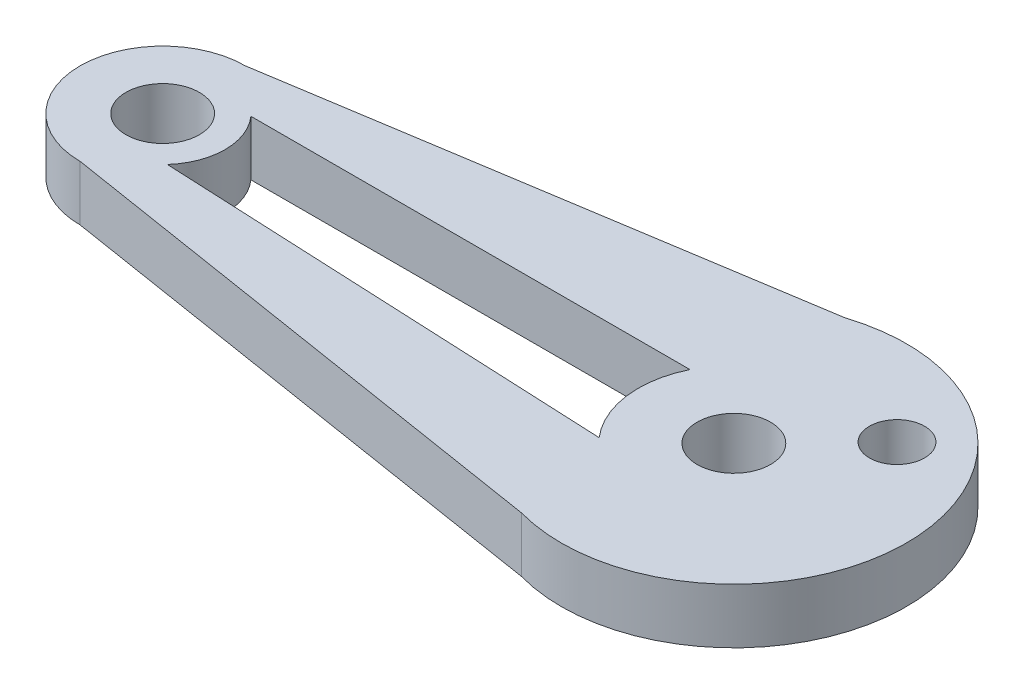
from build123d import *

# Parameters (mm, degrees)
SKETCH1_R           = 2
SKETCH1_R_2         = 1.5
BOSS_EXTRUDE1_DEPTH = 3


with BuildPart() as part:
    # Sketch1 → Boss-Extrude1 (new body)
    with BuildSketch(Plane(origin=(0, 0, 0), x_dir=(1, 0, 0), z_dir=(0, 1, 0))):
        with BuildLine():
            Line((-51.730151438, -5.002739553), (-23.52046035, -0.558125845))
            ThreePointArc((-23.52046035, -0.558125845), (-11.232359056, -9.299028138), (-23.130151438, -18.56419639))
            Line((-23.130151438, -18.56419639), (-51.730151438, -14.002739553))
            ThreePointArc((-51.730151438, -14.002739553), (-56.230151438, -9.502739553), (-51.730151438, -5.002739553))
        make_face()
        with Locations(Location((-20.630151438, -9.502739553, 0), (0, 0, 270))):
            Circle(SKETCH1_R, mode=Mode.SUBTRACT)
        with Locations(Location((-51.730151438, -9.502739553, 0), (0, 0, 270))):
            Circle(SKETCH1_R, mode=Mode.SUBTRACT)
        with Locations(Location((-16.247019321, -5.002739553, 0), (0, 0, 270))):
            Circle(SKETCH1_R_2, mode=Mode.SUBTRACT)
        with BuildLine():
            Line((-49.20201043, -7.229305358), (-25.30201043, -7.219379406))
            ThreePointArc((-25.30201043, -7.219379406), (-25.78692763, -10.171813025), (-24.564614553, -12.902739553))
            Line((-24.564614553, -12.902739553), (-49.20201043, -11.776173749))
            ThreePointArc((-49.20201043, -11.776173749), (-48.330151438, -9.502739553), (-49.20201043, -7.229305358))
        make_face(mode=Mode.SUBTRACT)
    extrude(amount=BOSS_EXTRUDE1_DEPTH)


solid = part.part
